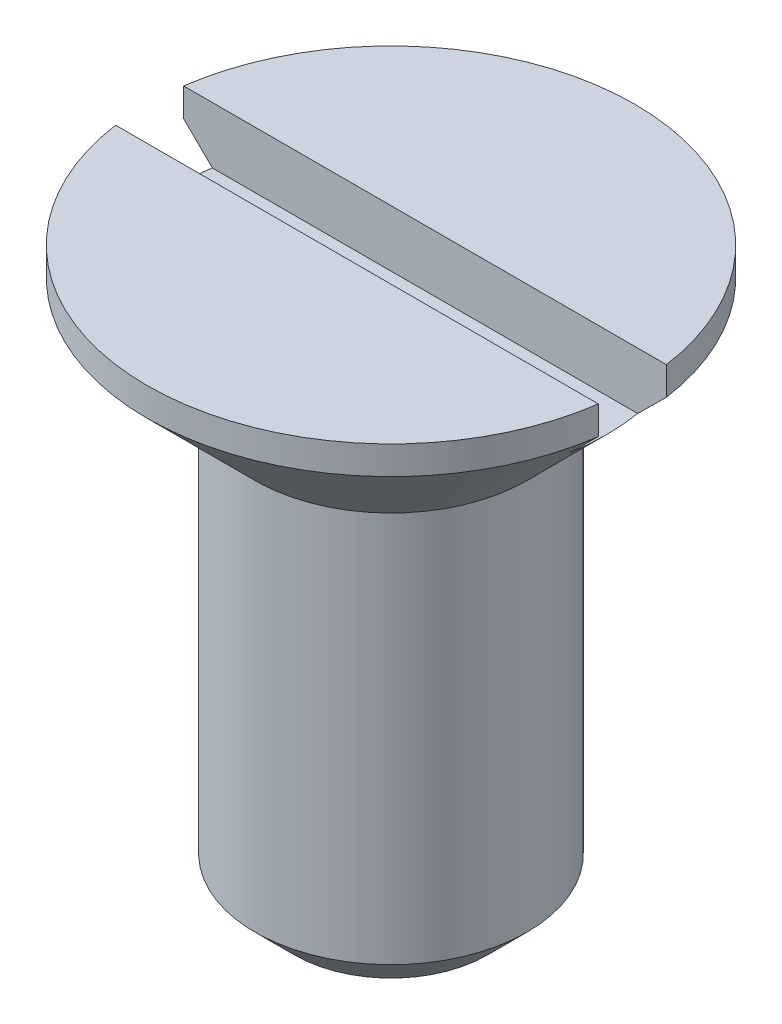
from build123d import *

# Parameters (mm, degrees)
SKETCH_13_W         = 21.5
SKETCH_13_H         = 3
CUT_EXTRUDE_9_DEPTH = 2.5
CHAMFER_1_SIZE      = 1.75


with BuildPart() as part:
    # Эскиз1 → Повернуть1 (revolve)
    with BuildSketch(Plane.XY):
        Polygon((0, 92.035042223), (0, 67.035042223), (6, 67.035042223), (6, 86.035042223), (10.75, 90.785042223), (10.75, 92.035042223), align=None)
    revolve(axis=Axis((0, 125.763182898, 0), (0, -1, 0)))

    # Эскиз13 → Вырез-Вытянуть9 (cut)
    with BuildSketch(Plane(origin=(0, 92.035042223, 0), x_dir=(-1, 0, 0), z_dir=(0, 1, 0))):
        Rectangle(SKETCH_13_W, SKETCH_13_H)
    extrude(amount=-CUT_EXTRUDE_9_DEPTH, mode=Mode.SUBTRACT)

    # Фаска1
    chamfer_1_edges = [part.edges().sort_by_distance(p)[0] for p in [
        (-6, 67.035042223, 0),
    ]]
    chamfer(chamfer_1_edges, length=CHAMFER_1_SIZE)


solid = part.part
